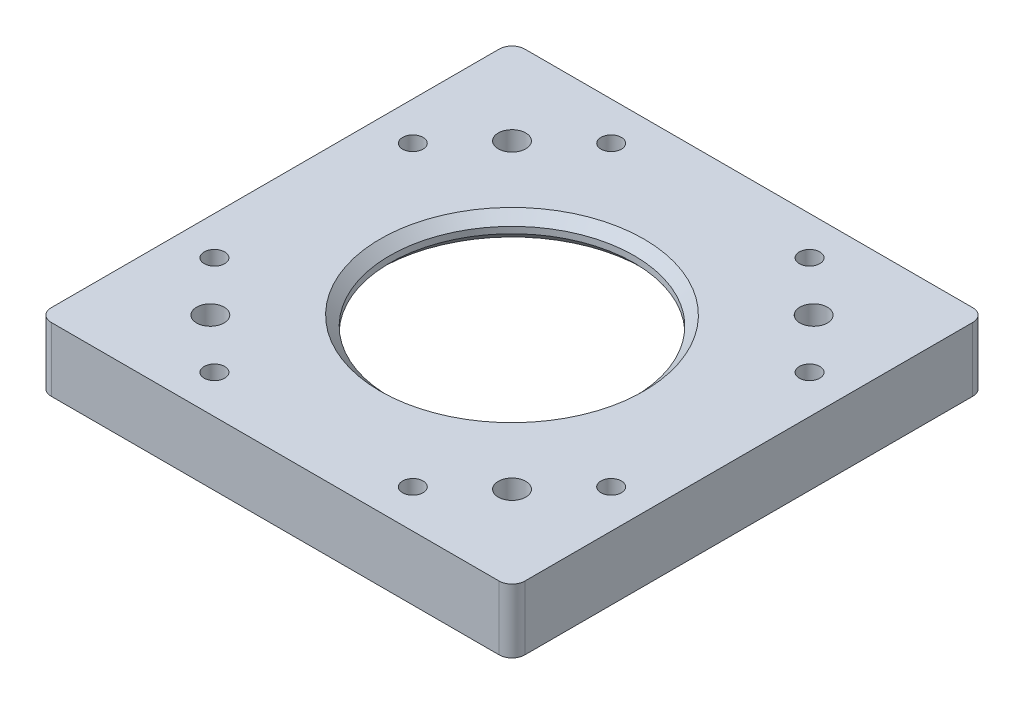
from build123d import *

# Parameters (mm, degrees)
SKETCH1_W           = 74
SKETCH1_H           = 74
SKETCH1_R           = 2.15
SKETCH1_R_2         = 19.1
SKETCH1_R_3         = 1.6
BOSS_EXTRUDE1_DEPTH = 10
SKETCH2_W           = 57.2
SKETCH2_H           = 57.2
CUT_EXTRUDE1_DEPTH  = 6
FILLET1_R           = 3
CHAMFER1_SIZE       = 1.5
FILLET2_R           = 2


with BuildPart() as part:
    # Sketch1 → Boss-Extrude1 (new body)
    with BuildSketch(Plane(origin=(0, 0, 0), x_dir=(1, 0, 0), z_dir=(0, 1, 0))):
        Rectangle(SKETCH1_W, SKETCH1_H)
        with Locations(Location((23.57, 23.57, 0), (0, 0, 270))):
            Circle(SKETCH1_R, mode=Mode.SUBTRACT)
        with Locations(Location((-23.57, 23.57, 0), (0, 0, 270))):
            Circle(SKETCH1_R, mode=Mode.SUBTRACT)
        with Locations(Location((-23.57, -23.57, 0), (0, 0, 270))):
            Circle(SKETCH1_R, mode=Mode.SUBTRACT)
        with Locations(Location((23.57, -23.57, 0), (0, 0, 270))):
            Circle(SKETCH1_R, mode=Mode.SUBTRACT)
        with Locations(Location((0, 0, 0), (0, 0, 270))):
            Circle(SKETCH1_R_2, mode=Mode.SUBTRACT)
        with Locations(Location((15.5, 31, 0), (0, 0, 270))):
            Circle(SKETCH1_R_3, mode=Mode.SUBTRACT)
        with Locations(Location((-15.5, 31, 0), (0, 0, 90))):
            Circle(SKETCH1_R_3, mode=Mode.SUBTRACT)
        with Locations(Location((31, -15.5, 0), (0, 0, 270))):
            Circle(SKETCH1_R_3, mode=Mode.SUBTRACT)
        with Locations(Location((31, 15.5, 0), (0, 0, 90))):
            Circle(SKETCH1_R_3, mode=Mode.SUBTRACT)
        with Locations(Location((-15.5, -31, 0), (0, 0, 270))):
            Circle(SKETCH1_R_3, mode=Mode.SUBTRACT)
        with Locations(Location((15.5, -31, 0), (0, 0, 90))):
            Circle(SKETCH1_R_3, mode=Mode.SUBTRACT)
        with Locations(Location((-31, 15.5, 0), (0, 0, 270))):
            Circle(SKETCH1_R_3, mode=Mode.SUBTRACT)
        with Locations(Location((-31, -15.5, 0), (0, 0, 90))):
            Circle(SKETCH1_R_3, mode=Mode.SUBTRACT)
    extrude(amount=BOSS_EXTRUDE1_DEPTH)

    # Sketch2 → Cut-Extrude1 (cut)
    with BuildSketch(Plane.XZ):
        Rectangle(SKETCH2_W, SKETCH2_H)
    extrude(amount=-CUT_EXTRUDE1_DEPTH, mode=Mode.SUBTRACT)

    # Fillet1
    fillet1_edges = [part.edges().sort_by_distance(p)[0] for p in [
        (28.6, 3, 28.6),
        (28.6, 3, -28.6),
        (-28.6, 3, -28.6),
        (-28.6, 3, 28.6),
    ]]
    fillet(fillet1_edges, radius=FILLET1_R)

    # Chamfer1
    chamfer1_edges = [part.edges().sort_by_distance(p)[0] for p in [
        (0, 10, -19.1),
        (0, 6, -19.1),
    ]]
    chamfer(chamfer1_edges, length=CHAMFER1_SIZE)

    # Fillet2
    fillet2_edges = [part.edges().sort_by_distance(p)[0] for p in [
        (37, 5, 37),
        (-37, 5, 37),
        (-37, 5, -37),
        (37, 5, -37),
    ]]
    fillet(fillet2_edges, radius=FILLET2_R)


solid = part.part
